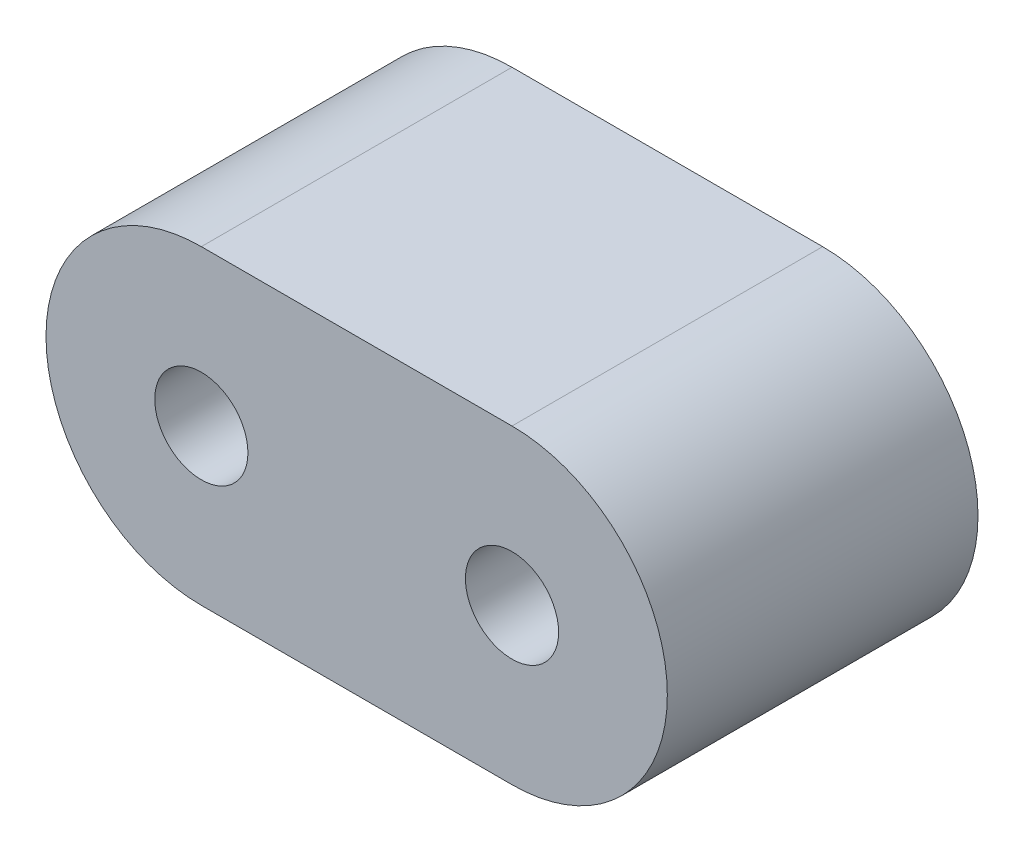
from build123d import *

# Parameters (mm, degrees)
EXTRUDE_1_DEPTH     = 10
SKETCH_2_R          = 1.5
CUT_EXTRUDE_1_DEPTH = 10


with BuildPart() as part:
    # 草图1 → 凸台-拉伸1 (new body)
    with BuildSketch(Plane.XY):
        with BuildLine():
            Line((0, -5), (-10, -5))
            ThreePointArc((-10, -5), (-15, 0), (-10, 5))
            Line((-10, 5), (0, 5))
            ThreePointArc((0, 5), (5, 0), (0, -5))
        make_face()
    extrude(amount=EXTRUDE_1_DEPTH)

    # 草图2 → 切除-拉伸1 (cut)
    with BuildSketch(Plane.XY.offset(10)):
        Circle(SKETCH_2_R)
        with Locations((-10, 0)):
            Circle(SKETCH_2_R)
    extrude(amount=-CUT_EXTRUDE_1_DEPTH, mode=Mode.SUBTRACT)


solid = part.part
